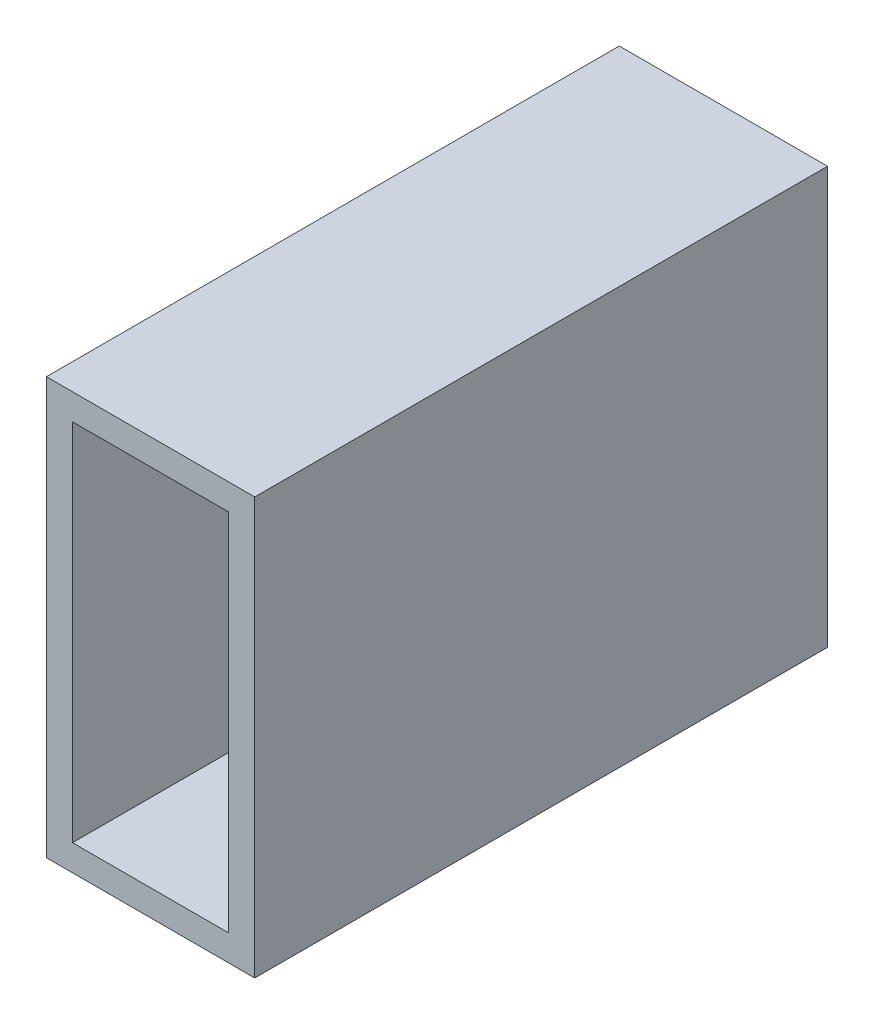
from build123d import *

# Parameters (mm, degrees)
SKETCH1_W           = 25.4
SKETCH1_H           = 50.8
SKETCH1_W_2         = 19.05
SKETCH1_H_2         = 44.45
BOSS_EXTRUDE1_DEPTH = 69.85


with BuildPart() as part:
    # Sketch1 → Boss-Extrude1 (new body)
    with BuildSketch(Plane.XY):
        with Locations((12.7, 25.4)):
            Rectangle(SKETCH1_W, SKETCH1_H)
        with Locations((12.7, 25.4)):
            Rectangle(SKETCH1_W_2, SKETCH1_H_2, mode=Mode.SUBTRACT)
    extrude(amount=BOSS_EXTRUDE1_DEPTH)


solid = part.part
